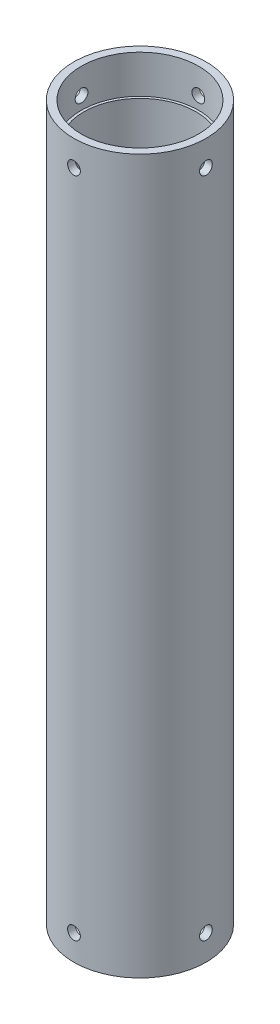
from build123d import *

# Parameters (mm, degrees)
SKETCH_1_R               = 26
SKETCH_1_R_2             = 22.05
EXTRUDE_1_DEPTH          = 280
SKETCH_5_R               = 23.05
CUT_EXTRUDE_2_DEPTH      = 15
CUT_EXTRUDE_START        = -15
SKETCH_2_R               = 23.05
CUT_EXTRUDE_3_DEPTH      = 15
CUT_EXTRUDE_4_DEPTH      = 46
CUT_EXTRUDE_4_DEPTH_BACK = 47
SKETCH_6_R               = 2.5
CUT_EXTRUDE_5_DEPTH      = 60
CUT_EXTRUDE_5_DEPTH_BACK = 58
SKETCH_8_R               = 2.5
CUT_EXTRUDE_6_DEPTH      = 80
CUT_EXTRUDE_6_DEPTH_BACK = 61
SKETCH_9_R               = 2.5
CUT_EXTRUDE_7_DEPTH      = 102
CUT_EXTRUDE_7_DEPTH_BACK = 81
SKETCH_10_R              = 2.5


with BuildPart() as part:
    # 스케치1 → 보스-돌출1 (new body)
    with BuildSketch(Plane(origin=(0, 0, 0), x_dir=(1, 0, 0), z_dir=(0, 1, 0))):
        with Locations(Location((0, 0, 0), (0, 0, 270))):
            Circle(SKETCH_1_R)
        with Locations(Location((0, 0, 0), (0, 0, 270))):
            Circle(SKETCH_1_R_2, mode=Mode.SUBTRACT)
    extrude(amount=EXTRUDE_1_DEPTH)

    # 스케치5 → 컷-돌출2 (cut)
    with BuildSketch(Plane(origin=(0, 280, 0), x_dir=(1, 0, 0), z_dir=(0, 1, 0))):
        with Locations(Location((0, 0, 0), (0, 0, 270))):
            Circle(SKETCH_5_R)
    extrude(amount=-CUT_EXTRUDE_2_DEPTH, mode=Mode.SUBTRACT)

    # 스케치2 → 컷-돌출3 (cut)
    with BuildSketch(Plane.XZ.offset(CUT_EXTRUDE_START)):
        with Locations(Location((0, 0, 0), (0, 0, 90))):
            Circle(SKETCH_2_R)
    extrude(amount=CUT_EXTRUDE_3_DEPTH, mode=Mode.SUBTRACT)

    # 스케치6 → 컷-돌출4 (cut, two sides: drawn at the far end of the back side and taken through both)
    with BuildSketch(Plane.XY.offset(-CUT_EXTRUDE_4_DEPTH_BACK)):
        with Locations(Location((0, 10, 0), (0, 0, 180))):
            Circle(SKETCH_6_R)
    extrude(amount=CUT_EXTRUDE_4_DEPTH + CUT_EXTRUDE_4_DEPTH_BACK, mode=Mode.SUBTRACT)

    # 스케치8 → 컷-돌출5 (cut, two sides: drawn at the far end of the back side and taken through both)
    with BuildSketch(Plane(origin=(0, 0, 0), x_dir=(0, 0, -1), z_dir=(1, 0, 0)).offset(-CUT_EXTRUDE_5_DEPTH_BACK)):
        with Locations((0, 9.977061327)):
            Circle(SKETCH_8_R)
    extrude(amount=CUT_EXTRUDE_5_DEPTH + CUT_EXTRUDE_5_DEPTH_BACK, mode=Mode.SUBTRACT)

    # 스케치9 → 컷-돌출6 (cut, two sides: drawn at the far end of the back side and taken through both)
    with BuildSketch(Plane.XY.offset(-CUT_EXTRUDE_6_DEPTH_BACK)):
        with Locations((0, 270)):
            Circle(SKETCH_9_R)
    extrude(amount=CUT_EXTRUDE_6_DEPTH + CUT_EXTRUDE_6_DEPTH_BACK, mode=Mode.SUBTRACT)

    # 스케치10 → 컷-돌출7 (cut, two sides: drawn at the far end of the back side and taken through both)
    with BuildSketch(Plane(origin=(0, 0, 0), x_dir=(0, 0, -1), z_dir=(1, 0, 0)).offset(-CUT_EXTRUDE_7_DEPTH_BACK)):
        with Locations((0, 270)):
            Circle(SKETCH_10_R)
    extrude(amount=CUT_EXTRUDE_7_DEPTH + CUT_EXTRUDE_7_DEPTH_BACK, mode=Mode.SUBTRACT)


solid = part.part
